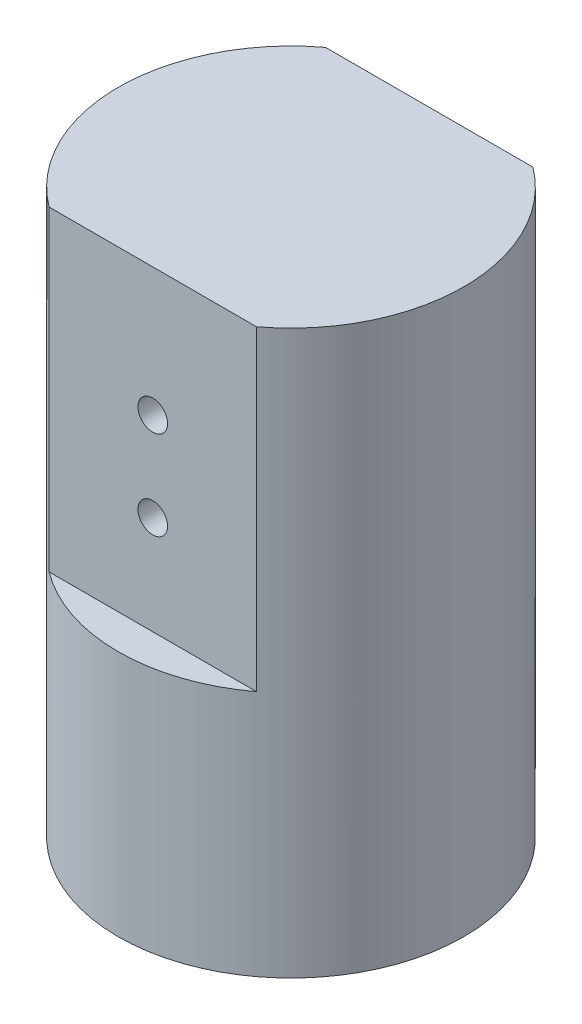
from build123d import *

# Parameters (mm, degrees)
SKETCH1_R           = 22.225
BOSS_EXTRUDE1_DEPTH = 91.44
CUT_EXTRUDE1_REACH  = 106.072
SKETCH2_W           = 4.445
SKETCH2_H           = 40.64
SKETCH4_R           = 1.905
CUT_EXTRUDE2_DEPTH  = 103.252746907
SKETCH6_W           = 44.45
SKETCH6_H           = 19.05
CUT_EXTRUDE3_DEPTH  = 685.739656498


with BuildPart() as part:
    # Sketch1 → Boss-Extrude1 (new body)
    with BuildSketch(Plane(origin=(0, 0, 0), x_dir=(1, 0, 0), z_dir=(0, 1, 0))):
        with Locations(Location((0, 0, 0), (0, 0, 270))):
            Circle(SKETCH1_R)
    extrude(amount=BOSS_EXTRUDE1_DEPTH)

    # Sketch2 → Cut-Extrude1 (cut, up to next)
    with BuildSketch(Plane(origin=(22.225, 0, 0), x_dir=(0, 0, -1), z_dir=(1, 0, 0)), mode=Mode.PRIVATE) as cut_extrude1_sk1:
        with Locations((-20.0025, 71.12)):
            Rectangle(SKETCH2_W, SKETCH2_H)
    cut_extrude1_tool1 = extrude(cut_extrude1_sk1.sketch, amount=-CUT_EXTRUDE1_REACH, mode=Mode.PRIVATE) & part.part
    # Sketch2 → Cut-Extrude1 (cut, up to next)
    with BuildSketch(Plane(origin=(22.225, 0, 0), x_dir=(0, 0, -1), z_dir=(1, 0, 0)), mode=Mode.PRIVATE) as cut_extrude1_sk2:
        with Locations((20.0025, 71.12)):
            Rectangle(SKETCH2_W, SKETCH2_H)
    cut_extrude1_tool2 = extrude(cut_extrude1_sk2.sketch, amount=-CUT_EXTRUDE1_REACH, mode=Mode.PRIVATE) & part.part
    add(cut_extrude1_tool1.solids().sort_by_distance((22.225, 71.12, 20.0025))[0], mode=Mode.SUBTRACT)
    add(cut_extrude1_tool2.solids().sort_by_distance((22.225, 71.12, -20.0025))[0], mode=Mode.SUBTRACT)

    # Sketch4 → Cut-Extrude2 (cut, through all)
    with BuildSketch(Plane.XY.offset(17.78)):
        with Locations((0, 74.93)):
            Circle(SKETCH4_R)
        with Locations((0, 63.5)):
            Circle(SKETCH4_R)
    extrude(amount=-CUT_EXTRUDE2_DEPTH, mode=Mode.SUBTRACT)

    # Sketch6 → Cut-Extrude3 (cut, through all)
    with BuildSketch(Plane(origin=(-69.793368373, -6.35, 649.219810065), x_dir=(0, 0, -1), z_dir=(1, 0, 0))):
        with Locations((649.219810065, 15.875)):
            Rectangle(SKETCH6_W, SKETCH6_H)
    extrude(amount=CUT_EXTRUDE3_DEPTH, mode=Mode.SUBTRACT)


solid = part.part
